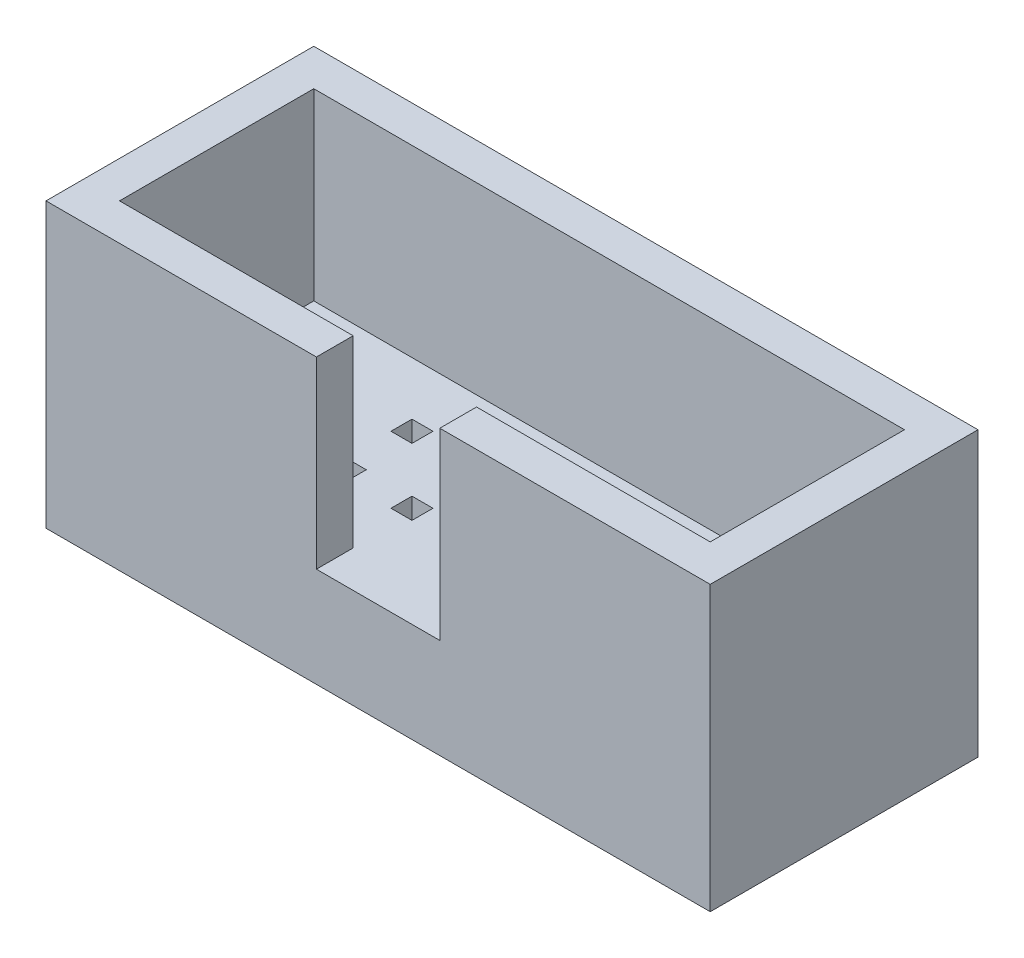
from build123d import *

# Parameters (mm, degrees)
SKETCH1_W            = 12.65
SKETCH1_H            = 5.1
BOSS_EXTRUDE1_DEPTH  = 5.4
SKETCH2_W            = 11.25
SKETCH2_H            = 3.7
CUT_EXTRUDE1_DEPTH   = 3.5
CUT_EXTRUDE2_REACH   = 11.756
SKETCH3_W            = 2.35
SKETCH3_H            = 3.5
CUT_EXTRUDE5_REACH   = 10.699
SKETCH4_W            = 0.4
SKETCH4_H            = 0.4
LPATTERN1_COUNT      = 5
LPATTERN1_PITCH      = 1.27
LPATTERN1_COUNT_DIR2 = 2
LPATTERN1_PITCH_DIR2 = 1.27


with BuildPart() as part:
    # Sketch1 → Boss-Extrude1 (new body)
    with BuildSketch(Plane(origin=(0, 0, 0), x_dir=(1, 0, 0), z_dir=(0, 1, 0))):
        Rectangle(SKETCH1_W, SKETCH1_H)
    extrude(amount=BOSS_EXTRUDE1_DEPTH)

    # Sketch2 → Cut-Extrude1 (cut)
    with BuildSketch(Plane(origin=(0, 5.4, 0), x_dir=(1, 0, 0), z_dir=(0, 1, 0))):
        Rectangle(SKETCH2_W, SKETCH2_H)
    extrude(amount=-CUT_EXTRUDE1_DEPTH, mode=Mode.SUBTRACT)

    # Sketch3 → Cut-Extrude2 (cut, up to next)
    with BuildSketch(Plane.XY.offset(2.55), mode=Mode.PRIVATE) as cut_extrude2_sk1:
        with Locations((0, 3.65)):
            Rectangle(SKETCH3_W, SKETCH3_H)
    cut_extrude2_tool1 = extrude(cut_extrude2_sk1.sketch, amount=-CUT_EXTRUDE2_REACH, mode=Mode.PRIVATE) & part.part
    add(cut_extrude2_tool1.solids().sort_by_distance((0, 3.65, 2.55))[0], mode=Mode.SUBTRACT)

    # Sketch4 → Cut-Extrude5 (cut, up to next)
    with BuildSketch(Plane.XZ, mode=Mode.PRIVATE) as cut_extrude5_sk1:
        with Locations((-2.54, 0.635)):
            Rectangle(SKETCH4_W, SKETCH4_H)
    cut_extrude5_tool1 = extrude(cut_extrude5_sk1.sketch, amount=-CUT_EXTRUDE5_REACH, mode=Mode.PRIVATE) & part.part
    cut_extrude5 = cut_extrude5_tool1.solids().sort_by_distance((-2.54, 0, 0.635))[0]
    add(cut_extrude5, mode=Mode.SUBTRACT)

    # LPattern1: Cut-Extrude5 5 × 2
    with Locations(*[(i * LPATTERN1_PITCH, 0, -j * LPATTERN1_PITCH_DIR2) for i in range(LPATTERN1_COUNT) for j in range(LPATTERN1_COUNT_DIR2) if (i, j) != (0, 0)]):
        add(cut_extrude5, mode=Mode.SUBTRACT)


solid = part.part
